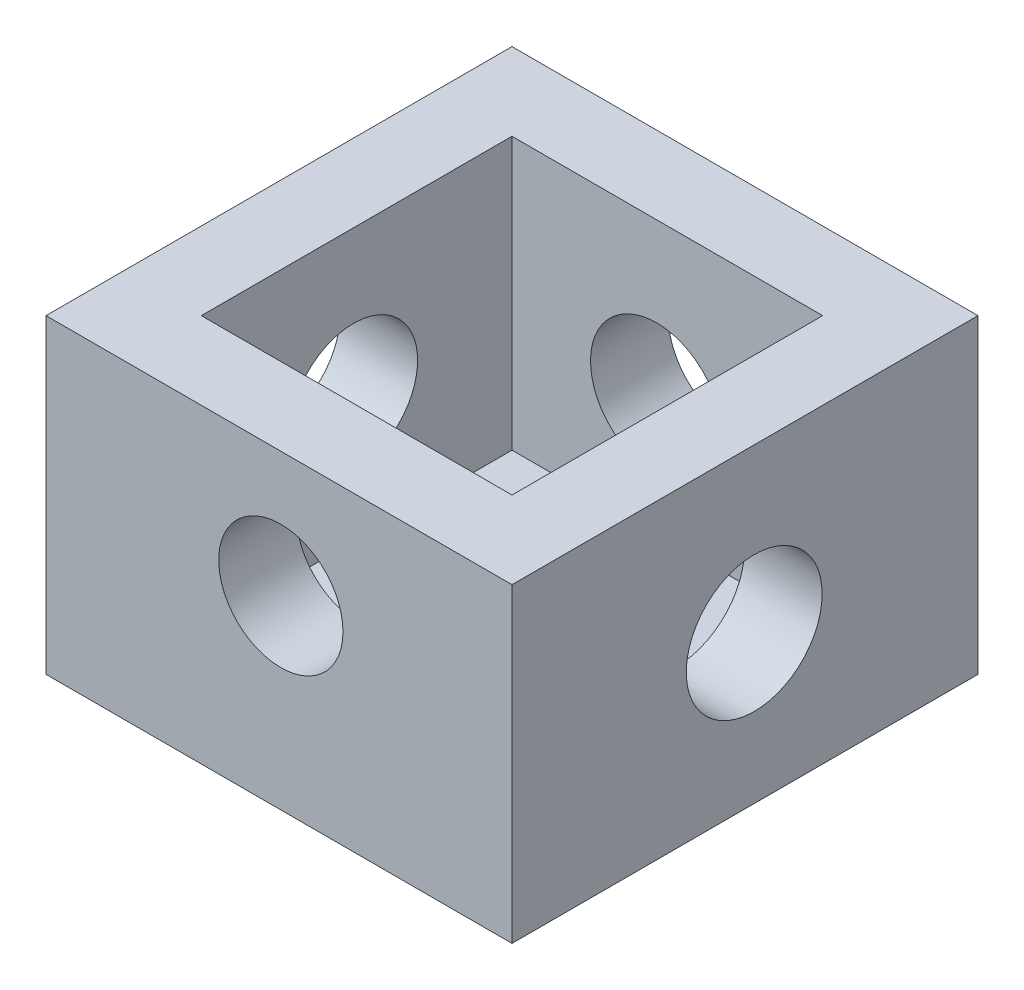
from build123d import *

# Parameters (mm, degrees)
SKETCH_1_W                    = 60
SKETCH_1_H                    = 60
EXTRUDE_2_DEPTH               = 40
SKETCH_2_W                    = 40
SKETCH_2_H                    = 40
CUT_EXTRUDE_1_DEPTH           = 35
HOLE_WIZARD_16_0_16_1_D       = 16
HOLE_WIZARD_16_0_16_1_DEPTH   = 10
HOLE_WIZARD_17_5_17_5_1_D     = 17.5
HOLE_WIZARD_17_5_17_5_1_DEPTH = 10
HOLE_WIZARD_16_5_16_5_1_D     = 16.5
HOLE_WIZARD_16_5_16_5_1_DEPTH = 10
HOLE_WIZARD_17_0_17_1_D       = 17
HOLE_WIZARD_17_0_17_1_DEPTH   = 10


with BuildPart() as part:
    # 草圖1 → 填料-伸長2 (new body)
    with BuildSketch(Plane(origin=(0, 0, 0), x_dir=(1, 0, 0), z_dir=(0, 1, 0))):
        with Locations((-17.631578947, 47.236842105)):
            Rectangle(SKETCH_1_W, SKETCH_1_H)
    extrude(amount=EXTRUDE_2_DEPTH)

    # 草圖2 → 除料-伸長1 (cut)
    with BuildSketch(Plane(origin=(0, 40, 0), x_dir=(1, 0, 0), z_dir=(0, 1, 0))):
        with Locations((-17.631578947, 47.236842105)):
            Rectangle(SKETCH_2_W, SKETCH_2_H)
    extrude(amount=-CUT_EXTRUDE_1_DEPTH, mode=Mode.SUBTRACT)

    # Ø16.0 (16) 直徑孔1
    with Locations(Plane(origin=(-17.39385665, 23.867389925, -17.236842105), x_dir=(1, 0, 0), z_dir=(0, 0, 1))):
        with Locations((0, 0)):
            Hole(HOLE_WIZARD_16_0_16_1_D / 2, depth=HOLE_WIZARD_16_0_16_1_DEPTH)

    # Ø17.5 (17.5) 直徑孔1
    with Locations(Plane(origin=(12.368421053, 19.014409134, -48.421566687), x_dir=(0, 0, 1), z_dir=(1, 0, 0))):
        with Locations((0, 0)):
            Hole(HOLE_WIZARD_17_5_17_5_1_D / 2, depth=HOLE_WIZARD_17_5_17_5_1_DEPTH)

    # Ø16.5 (16.5) 直徑孔1
    with Locations(Plane(origin=(-47.631578947, 21.093271668, -46.835113177), x_dir=(0, 0, -1), z_dir=(-1, 0, 0))):
        with Locations((0, 0)):
            Hole(HOLE_WIZARD_16_5_16_5_1_D / 2, depth=HOLE_WIZARD_16_5_16_5_1_DEPTH)

    # Ø17.0 (17) 直徑孔1
    with Locations(Plane(origin=(-19.022665384, 20.011822427, -77.236842105), x_dir=(-1, 0, 0), z_dir=(0, 0, -1))):
        with Locations((0, 0)):
            Hole(HOLE_WIZARD_17_0_17_1_D / 2, depth=HOLE_WIZARD_17_0_17_1_DEPTH)


solid = part.part
